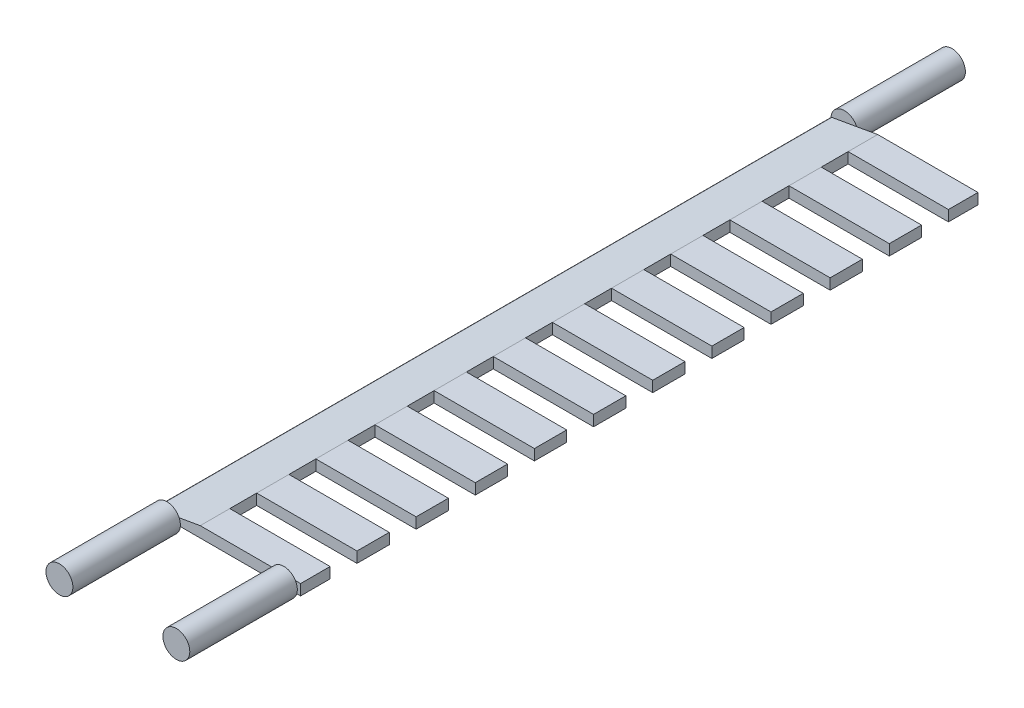
from build123d import *

# Parameters (mm, degrees)
EXTRUDE_1_DEPTH          = 63
SKETCH_2_W               = 37.314872722
SKETCH_2_H               = 5
CUT_EXTRUDE_1_DEPTH      = 50
PATTERN_LINEAR_1_COUNT   = 6
PATTERN_LINEAR_1_PITCH   = 11
MIRROR_1_COPY_1_SKETCH_W = 37.314872722
MIRROR_1_COPY_1_SKETCH_H = 5
MIRROR_1_COPY_1_DEPTH    = 50
MIRROR_1_COPY_2_SKETCH_W = 37.314872722
MIRROR_1_COPY_2_SKETCH_H = 5
MIRROR_1_COPY_2_DEPTH    = 50
MIRROR_1_COPY_3_SKETCH_W = 37.314872722
MIRROR_1_COPY_3_SKETCH_H = 5
MIRROR_1_COPY_3_DEPTH    = 50
MIRROR_1_COPY_4_SKETCH_W = 37.314872722
MIRROR_1_COPY_4_SKETCH_H = 5
MIRROR_1_COPY_4_DEPTH    = 50
MIRROR_1_COPY_5_SKETCH_W = 37.314872722
MIRROR_1_COPY_5_SKETCH_H = 5
MIRROR_1_COPY_5_DEPTH    = 50
MIRROR_1_COPY_6_SKETCH_W = 37.314872722
MIRROR_1_COPY_6_SKETCH_H = 5
MIRROR_1_COPY_6_DEPTH    = 50
EXTRUDE_START            = 63
SKETCH_3_R               = 2.5
EXTRUDE_2_DEPTH          = 20
SKETCH_4_R               = 2.5
EXTRUDE_3_DEPTH          = 20


with BuildPart() as part:
    # 草图1 → 凸台-拉伸1 (new, symmetric)
    with BuildSketch(Plane.XY):
        with BuildLine():
            Line((2.857513076, 0), (30, 0))
            Line((30, 0), (30, 2))
            Line((30, 2), (11.342563639, 2))
            Line((11.342563639, 2), (2.814101031, 0.496201938))
            ThreePointArc((2.814101031, 0.496201938), (2.608464401, 0.228211064), (2.857513076, 0))
        make_face()
    extrude(amount=EXTRUDE_1_DEPTH, both=True)

    # 草图2 → 切除-拉伸1 (cut, symmetric)
    with BuildSketch(Plane(origin=(0, 2, 0), x_dir=(1, 0, 0), z_dir=(0, 1, 0))):
        with Locations((30, 0)):
            Rectangle(SKETCH_2_W, SKETCH_2_H)
    cut_extrude_1 = extrude(amount=CUT_EXTRUDE_1_DEPTH, both=True, mode=Mode.SUBTRACT)

    # 阵列(线性)1: 切除-拉伸1 ×6
    with Locations(*[(0, 0, -i * PATTERN_LINEAR_1_PITCH) for i in range(1, PATTERN_LINEAR_1_COUNT)]):
        add(cut_extrude_1, mode=Mode.SUBTRACT)

    # 镜向1 copy 1 sketch → 镜向1 copy 1 (cut, symmetric)
    with BuildSketch(Plane(origin=(0, 2, 11), x_dir=(1, 0, 0), z_dir=(0, 1, 0))):
        with Locations((30, 0)):
            Rectangle(MIRROR_1_COPY_1_SKETCH_W, MIRROR_1_COPY_1_SKETCH_H)
    extrude(amount=MIRROR_1_COPY_1_DEPTH, both=True, mode=Mode.SUBTRACT)

    # 镜向1 copy 2 sketch → 镜向1 copy 2 (cut, symmetric)
    with BuildSketch(Plane(origin=(0, 2, 22), x_dir=(1, 0, 0), z_dir=(0, 1, 0))):
        with Locations((30, 0)):
            Rectangle(MIRROR_1_COPY_2_SKETCH_W, MIRROR_1_COPY_2_SKETCH_H)
    extrude(amount=MIRROR_1_COPY_2_DEPTH, both=True, mode=Mode.SUBTRACT)

    # 镜向1 copy 3 sketch → 镜向1 copy 3 (cut, symmetric)
    with BuildSketch(Plane(origin=(0, 2, 33), x_dir=(1, 0, 0), z_dir=(0, 1, 0))):
        with Locations((30, 0)):
            Rectangle(MIRROR_1_COPY_3_SKETCH_W, MIRROR_1_COPY_3_SKETCH_H)
    extrude(amount=MIRROR_1_COPY_3_DEPTH, both=True, mode=Mode.SUBTRACT)

    # 镜向1 copy 4 sketch → 镜向1 copy 4 (cut, symmetric)
    with BuildSketch(Plane(origin=(0, 2, 44), x_dir=(1, 0, 0), z_dir=(0, 1, 0))):
        with Locations((30, 0)):
            Rectangle(MIRROR_1_COPY_4_SKETCH_W, MIRROR_1_COPY_4_SKETCH_H)
    extrude(amount=MIRROR_1_COPY_4_DEPTH, both=True, mode=Mode.SUBTRACT)

    # 镜向1 copy 5 sketch → 镜向1 copy 5 (cut, symmetric)
    with BuildSketch(Plane(origin=(0, 2, 55), x_dir=(1, 0, 0), z_dir=(0, 1, 0))):
        with Locations((30, 0)):
            Rectangle(MIRROR_1_COPY_5_SKETCH_W, MIRROR_1_COPY_5_SKETCH_H)
    extrude(amount=MIRROR_1_COPY_5_DEPTH, both=True, mode=Mode.SUBTRACT)

    # 镜向1 copy 6 sketch → 镜向1 copy 6 (cut, symmetric)
    with BuildSketch(Plane(origin=(0, 2, 0), x_dir=(1, 0, 0), z_dir=(0, 1, 0))):
        with Locations((30, 0)):
            Rectangle(MIRROR_1_COPY_6_SKETCH_W, MIRROR_1_COPY_6_SKETCH_H)
    extrude(amount=MIRROR_1_COPY_6_DEPTH, both=True, mode=Mode.SUBTRACT)

    # 草图3 → 凸台-拉伸2 (add)
    with BuildSketch(Plane.XY.offset(EXTRUDE_START)):
        with Locations(Location((5.155322669, 0.262603589, 0), (0, 0, 176.797698594))):
            Circle(SKETCH_3_R)
    extrude_2 = extrude(amount=EXTRUDE_2_DEPTH)

    # 镜向2: 凸台-拉伸2 across plane
    add(extrude_2.mirror(Plane.XY))

    # 草图4 → 凸台-拉伸3 (add, through all)
    with BuildSketch(Plane.XY.offset(63)):
        with Locations(Location((26.90226766, 0.725038627, 0), (0, 0, 196.858881031))):
            Circle(SKETCH_4_R)
    extrude(amount=EXTRUDE_3_DEPTH)


solid = part.part
